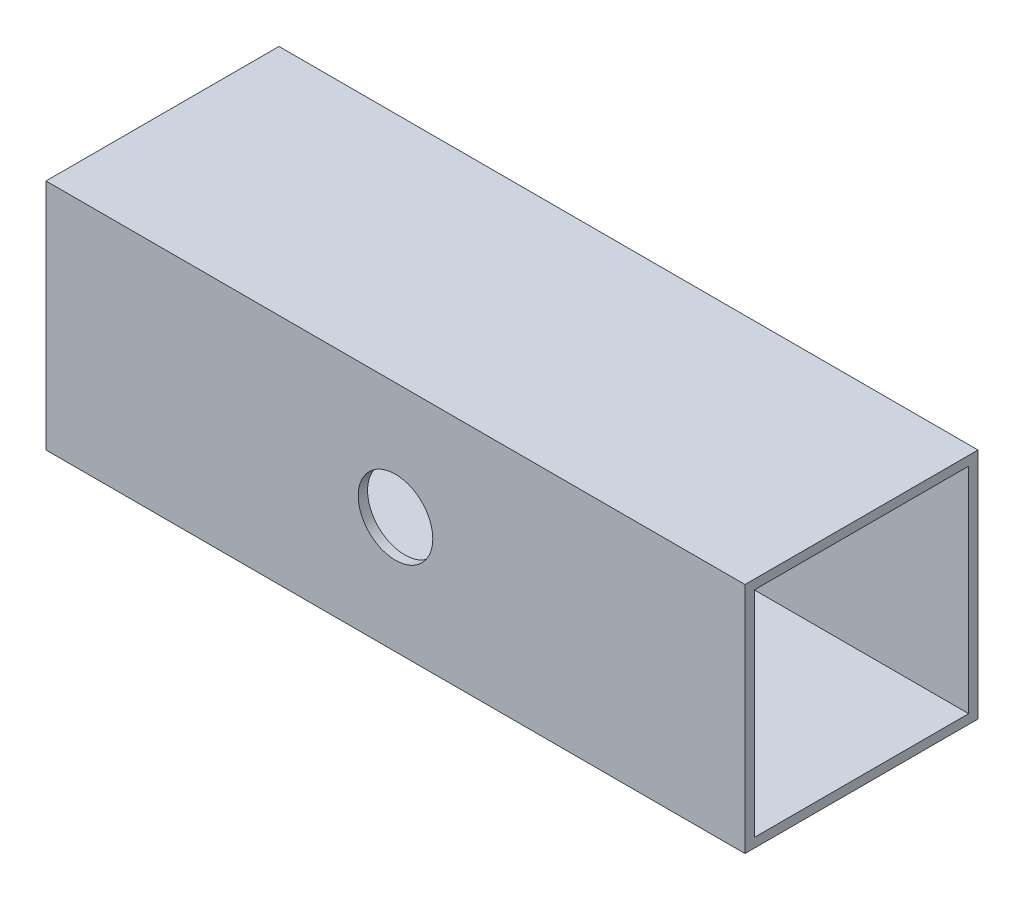
from build123d import *

# Parameters (mm, degrees)
SKETCH1_W           = 25
SKETCH1_H           = 25
SKETCH1_W_2         = 23
SKETCH1_H_2         = 23
BOSS_EXTRUDE1_DEPTH = 75
SKETCH2_R           = 4
CUT_EXTRUDE1_DEPTH  = 81.039052968


with BuildPart() as part:
    # Sketch1 → Boss-Extrude1 (new body)
    with BuildSketch(Plane(origin=(0, 0, 0), x_dir=(0, 0, -1), z_dir=(1, 0, 0))):
        Rectangle(SKETCH1_W, SKETCH1_H)
        Rectangle(SKETCH1_W_2, SKETCH1_H_2, mode=Mode.SUBTRACT)
    extrude(amount=BOSS_EXTRUDE1_DEPTH)

    # Sketch2 → Cut-Extrude1 (cut, through all)
    with BuildSketch(Plane.XY.offset(12.5)):
        with Locations((37.5, 0)):
            Circle(SKETCH2_R)
    extrude(amount=-CUT_EXTRUDE1_DEPTH, mode=Mode.SUBTRACT)


solid = part.part
